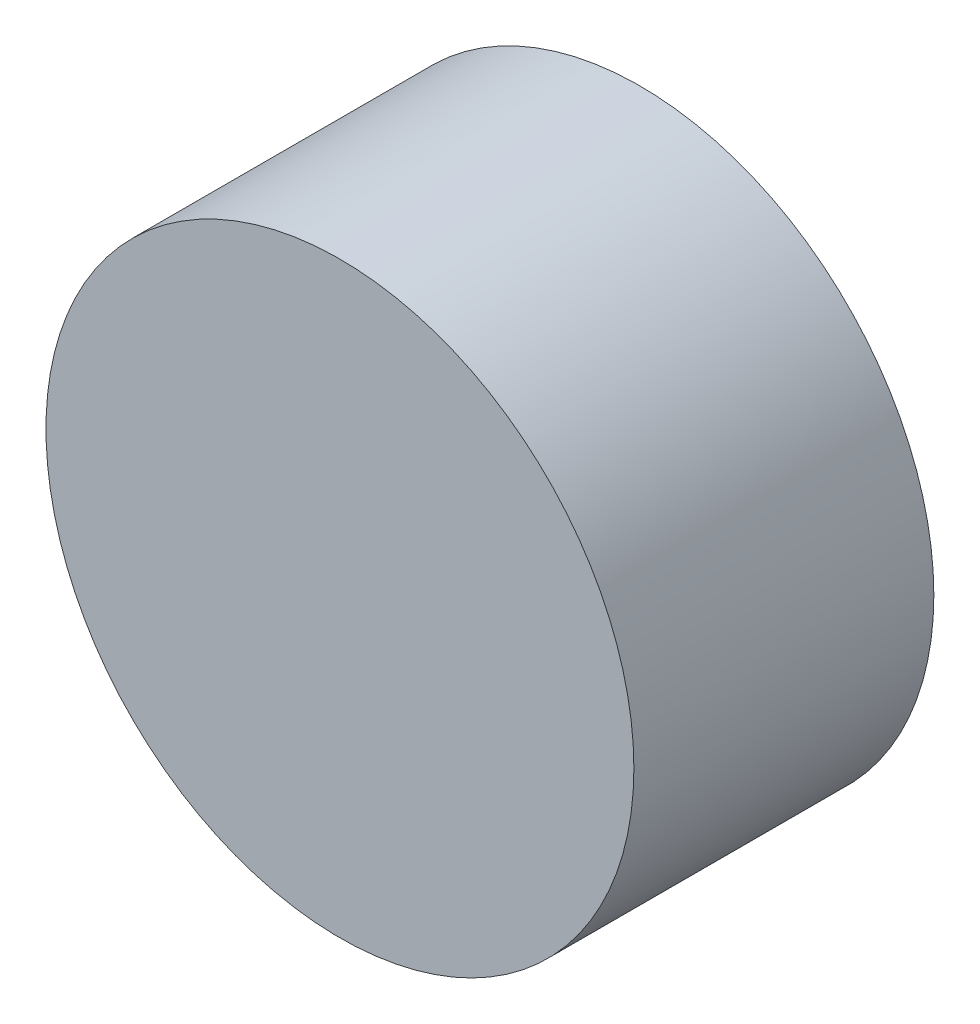
from build123d import *

# Parameters (mm, degrees)
CROQUIS1_R              = 12.25
CROQUIS1_R_2            = 11.5
SALIENTE_EXTRUIR1_DEPTH = 11
CROQUIS2_R              = 12.25
SALIENTE_EXTRUIR2_DEPTH = 1.5


with BuildPart() as part:
    # Croquis1 → Saliente-Extruir1 (new body)
    with BuildSketch(Plane.XY):
        Circle(CROQUIS1_R)
        Circle(CROQUIS1_R_2, mode=Mode.SUBTRACT)
    extrude(amount=SALIENTE_EXTRUIR1_DEPTH)

    # Croquis2 → Saliente-Extruir2 (add)
    with BuildSketch(Plane.XY.offset(11)):
        Circle(CROQUIS2_R)
    extrude(amount=SALIENTE_EXTRUIR2_DEPTH)


solid = part.part
